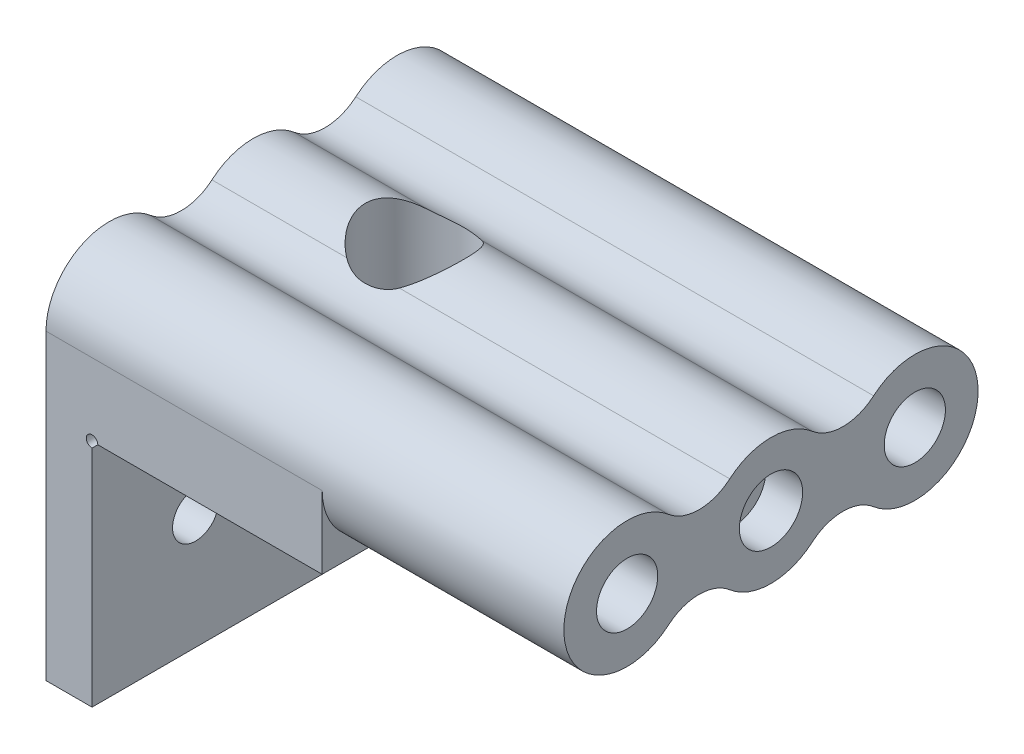
from build123d import *

# Parameters (mm, degrees)
BOSS_EXTRUDE1_DEPTH             = 18
BOSS_EXTRUDE2_REACH             = 40.419
BOSS_EXTRUDE2_DIRECTION_2_DEPTH = 21
SKETCH10_W                      = 24
SKETCH10_H                      = 36
BOSS_EXTRUDE4_DEPTH             = 2.3
CUT_EXTRUDE1_DEPTH              = 58.967577144
CUT_EXTRUDE1_DEPTH_BACK         = 58.967577144
SKETCH4_R                       = 2.6605
SKETCH4_3_R                     = 2.75
CUT_EXTRUDE2_DEPTH              = 3.2
CUT_EXTRUDE3_DEPTH              = 55.920305899
CUT_EXTRUDE3_DEPTH_BACK         = 55.920305899
SKETCH6_R                       = 2
SKETCH8_R                       = 2
CUT_EXTRUDE4_DEPTH              = 58.967577144
SKETCH8_3_R                     = 4.25
SKETCH8_3_R_2                   = 2
CUT_EXTRUDE5_DEPTH              = 8.8


with BuildPart() as part:
    # Sketch1 → Boss-Extrude1 (new, symmetric)
    with BuildSketch(Plane.XY):
        with BuildLine():
            Line((0, 0), (4, 0))
            Line((4, 0), (4, 19.5))
            ThreePointArc((4, 19.5), (3.646446609, 20.353553391), (4.5, 20))
            Line((4.5, 20), (24, 20))
            Line((24, 20), (24, 24))
            Line((24, 24), (0, 24))
            Line((0, 24), (0, 0))
        make_face()
    extrude(amount=BOSS_EXTRUDE1_DEPTH, both=True)

    # Boss-Extrude2: up to this face of the body (flat: up to its plane)
    boss_extrude2_end = Plane(part.part.faces().sort_by_distance((0, 12, 0))[0])
    # Sketch3 → Boss-Extrude2 (add, up to the picked face)
    with BuildSketch(Plane.ZY.offset(-24), mode=Mode.PRIVATE) as boss_extrude2_sk1:
        with BuildLine():
            ThreePointArc((8.919270833, 22.125269034), (6.25, 23.11319686), (3.580729167, 22.125269034))
            ThreePointArc((3.580729167, 22.125269034), (0, 20.8), (-3.580729167, 22.125269034))
            ThreePointArc((-3.580729167, 22.125269034), (-6.25, 23.11319686), (-8.919270833, 22.125269034))
            ThreePointArc((-8.919270833, 22.125269034), (-18, 26.3), (-8.919270833, 30.474730966))
            ThreePointArc((-8.919270833, 30.474730966), (-6.25, 29.48680314), (-3.580729167, 30.474730966))
            ThreePointArc((-3.580729167, 30.474730966), (0, 31.8), (3.580729167, 30.474730966))
            ThreePointArc((3.580729167, 30.474730966), (6.25, 29.48680314), (8.919270833, 30.474730966))
            ThreePointArc((8.919270833, 30.474730966), (18, 26.3), (8.919270833, 22.125269034))
        make_face()
    boss_extrude2_tool1 = split(extrude(boss_extrude2_sk1.sketch, amount=BOSS_EXTRUDE2_REACH, mode=Mode.PRIVATE), bisect_by=boss_extrude2_end, keep=Keep.BOTH, mode=Mode.PRIVATE)
    add(boss_extrude2_tool1.solids().sort_by(Axis((24, 26.3, 0), (-1, 0, 0)))[0])

    # Sketch3 → Boss-Extrude2 direction 2 (add)
    with BuildSketch(Plane.ZY.offset(-24)):
        with BuildLine():
            ThreePointArc((8.919270833, 22.125269034), (6.25, 23.11319686), (3.580729167, 22.125269034))
            ThreePointArc((3.580729167, 22.125269034), (0, 20.8), (-3.580729167, 22.125269034))
            ThreePointArc((-3.580729167, 22.125269034), (-6.25, 23.11319686), (-8.919270833, 22.125269034))
            ThreePointArc((-8.919270833, 22.125269034), (-18, 26.3), (-8.919270833, 30.474730966))
            ThreePointArc((-8.919270833, 30.474730966), (-6.25, 29.48680314), (-3.580729167, 30.474730966))
            ThreePointArc((-3.580729167, 30.474730966), (0, 31.8), (3.580729167, 30.474730966))
            ThreePointArc((3.580729167, 30.474730966), (6.25, 29.48680314), (8.919270833, 30.474730966))
            ThreePointArc((8.919270833, 30.474730966), (18, 26.3), (8.919270833, 22.125269034))
        make_face()
    extrude(amount=-BOSS_EXTRUDE2_DIRECTION_2_DEPTH)

    # Sketch10 → Boss-Extrude4 (add)
    with BuildSketch(Plane(origin=(0, 24, 0), x_dir=(1, 0, 0), z_dir=(0, 1, 0))):
        with Locations((12, 0)):
            Rectangle(SKETCH10_W, SKETCH10_H)
    extrude(amount=BOSS_EXTRUDE4_DEPTH)

    # Sketch4 → Cut-Extrude1 (cut, two sides: drawn at the far end of the back side and taken through both)
    with BuildSketch(Plane(origin=(45, 0, 0), x_dir=(0, 0, -1), z_dir=(1, 0, 0)).offset(-CUT_EXTRUDE1_DEPTH_BACK)):
        with Locations((-12.5, 26.3)):
            Circle(SKETCH4_R)
        with Locations((12.5, 26.3)):
            Circle(SKETCH4_R)
    extrude(amount=CUT_EXTRUDE1_DEPTH + CUT_EXTRUDE1_DEPTH_BACK, mode=Mode.SUBTRACT)

    # Sketch4<3> → Cut-Extrude2 (cut)
    with BuildSketch(Plane(origin=(45, 0, 0), x_dir=(0, 0, -1), z_dir=(1, 0, 0))):
        with Locations((0, 26.3)):
            Circle(SKETCH4_3_R)
    extrude(amount=-CUT_EXTRUDE2_DEPTH, mode=Mode.SUBTRACT)

    # Sketch6 → Cut-Extrude3 (cut, two sides: drawn at the far end of the back side and taken through both)
    with BuildSketch(Plane(origin=(4, 0, 0), x_dir=(0, 0, -1), z_dir=(1, 0, 0)).offset(-CUT_EXTRUDE3_DEPTH_BACK)):
        with Locations((-9, 10)):
            Circle(SKETCH6_R)
        with Locations((9, 10)):
            Circle(SKETCH6_R)
    extrude(amount=CUT_EXTRUDE3_DEPTH + CUT_EXTRUDE3_DEPTH_BACK, mode=Mode.SUBTRACT)

    # Sketch8 → Cut-Extrude4 (cut, through all)
    with BuildSketch(Plane(origin=(0, 31.8, 0), x_dir=(1, 0, 0), z_dir=(0, 1, 0))):
        with Locations(Location((14, 0, 0), (0, 0, 270))):
            Circle(SKETCH8_R)
    extrude(amount=-CUT_EXTRUDE4_DEPTH, mode=Mode.SUBTRACT)

    # Sketch8<3> → Cut-Extrude5 (cut)
    with BuildSketch(Plane(origin=(0, 31.8, 0), x_dir=(1, 0, 0), z_dir=(0, 1, 0))):
        with Locations(Location((14, 0, 0), (0, 0, 270))):
            Circle(SKETCH8_3_R)
        with Locations(Location((14, 0, 0), (0, 0, 270))):
            Circle(SKETCH8_3_R_2, mode=Mode.SUBTRACT)
    extrude(amount=-CUT_EXTRUDE5_DEPTH, mode=Mode.SUBTRACT)


solid = part.part
